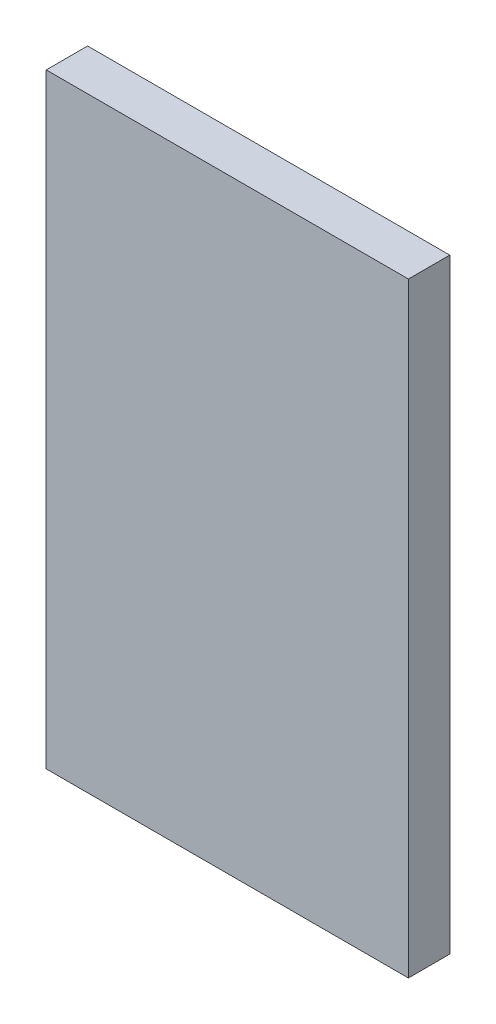
from build123d import *

# Parameters (mm, degrees)
SKETCH_1_W      = 70
SKETCH_1_H      = 117
EXTRUDE_1_DEPTH = 8


with BuildPart() as part:
    # 스케치1 → 보스-돌출1 (new body)
    with BuildSketch(Plane.XY):
        with Locations((-4.684349192, -18.924836601)):
            Rectangle(SKETCH_1_W, SKETCH_1_H)
    extrude(amount=EXTRUDE_1_DEPTH)


solid = part.part
